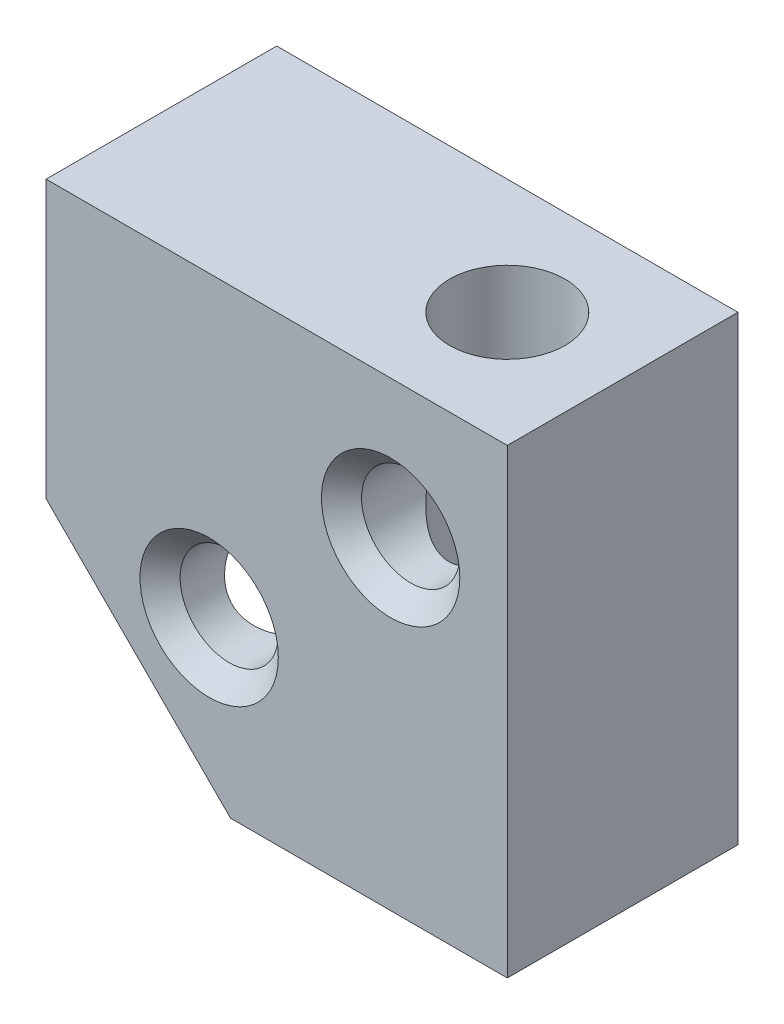
from build123d import *

# Parameters (mm, degrees)
SKETCH1_W                         = 25.4
SKETCH1_H                         = 25.4
BOSS_EXTRUDE1_DEPTH               = 12.7
CHAMFER1_SIZE                     = 10.16
SKETCH2_R                         = 3.175
CUT_EXTRUDE1_DEPTH                = 25.4
SKETCH3_R                         = 3.175
CUT_EXTRUDE2_DEPTH                = 10.16
F_1_4_28_TAPPED_HOLE1_D           = 5.4102
F_1_4_28_TAPPED_HOLE1_DEPTH       = 15.494
F_1_4_28_TAPPED_HOLE1_CSINK_D     = 7.62
F_1_4_28_TAPPED_HOLE1_CSINK_ANGLE = 90
F_1_4_28_TAPPED_HOLE1_TIP         = 1.625388061


with BuildPart() as part:
    # Sketch1 → Boss-Extrude1 (new body)
    with BuildSketch(Plane.XY):
        with Locations((12.7, 12.7)):
            Rectangle(SKETCH1_W, SKETCH1_H)
    extrude(amount=BOSS_EXTRUDE1_DEPTH)

    # Chamfer1
    chamfer1_edges = [part.edges().sort_by_distance(p)[0] for p in [
        (0, 0, 6.35),
    ]]
    chamfer(chamfer1_edges, length=CHAMFER1_SIZE)

    # Sketch2 → Cut-Extrude1 (cut)
    with BuildSketch(Plane(origin=(0, 25.4, 0), x_dir=(1, 0, 0), z_dir=(0, 1, 0))):
        with Locations(Location((19.05, -6.35, 0), (0, 0, 270))):
            Circle(SKETCH2_R)
    extrude(amount=-CUT_EXTRUDE1_DEPTH, mode=Mode.SUBTRACT)

    # Sketch3 → Cut-Extrude2 (cut)
    with BuildSketch(Plane(origin=(5.08, 5.08, 0), x_dir=(0, 0, 1), z_dir=(-0.7071067811865488, -0.7071067811865462, 0))):
        with Locations(Location((6.35, 0, 0), (0, 0, 270))):
            Circle(SKETCH3_R)
    extrude(amount=-CUT_EXTRUDE2_DEPTH, mode=Mode.SUBTRACT)

    # 1/4-28 Tapped Hole1
    with Locations(Plane.XY.offset(12.7)):
        with Locations((8.980256121, 8.980256121), (18.974124868, 17.78)):
            CounterSinkHole(F_1_4_28_TAPPED_HOLE1_D / 2, F_1_4_28_TAPPED_HOLE1_CSINK_D / 2, depth=F_1_4_28_TAPPED_HOLE1_DEPTH, counter_sink_angle=F_1_4_28_TAPPED_HOLE1_CSINK_ANGLE)
            with Locations((0, 0, -(F_1_4_28_TAPPED_HOLE1_DEPTH + F_1_4_28_TAPPED_HOLE1_TIP / 2))):  # 118° drill point
                Cone(0, F_1_4_28_TAPPED_HOLE1_D / 2, F_1_4_28_TAPPED_HOLE1_TIP, mode=Mode.SUBTRACT)


solid = part.part
